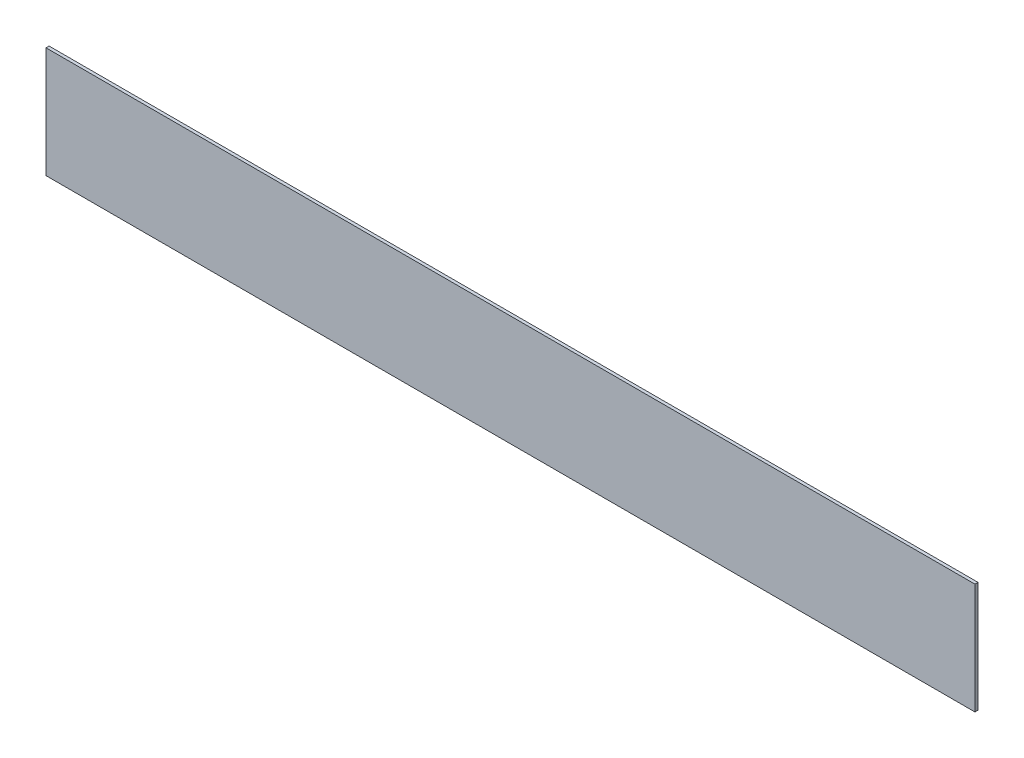
from build123d import *

# Parameters (mm, degrees)
CEK_1L_KULP_CUKURU_1_0_1_START = 26
SKETCH1_W                      = 302
SKETCH1_H                      = 36
CEK_1L_KULP_CUKURU_1_0_1_DEPTH = 1


with BuildPart() as part:
    # Sketch1 → CEK_1L_kulp_cukuru_1.0_1 (new body)
    with BuildSketch(Plane.XY.offset(CEK_1L_KULP_CUKURU_1_0_1_START)):
        with Locations((309, 267)):
            Rectangle(SKETCH1_W, SKETCH1_H)
    extrude(amount=CEK_1L_KULP_CUKURU_1_0_1_DEPTH)


solid = part.part
